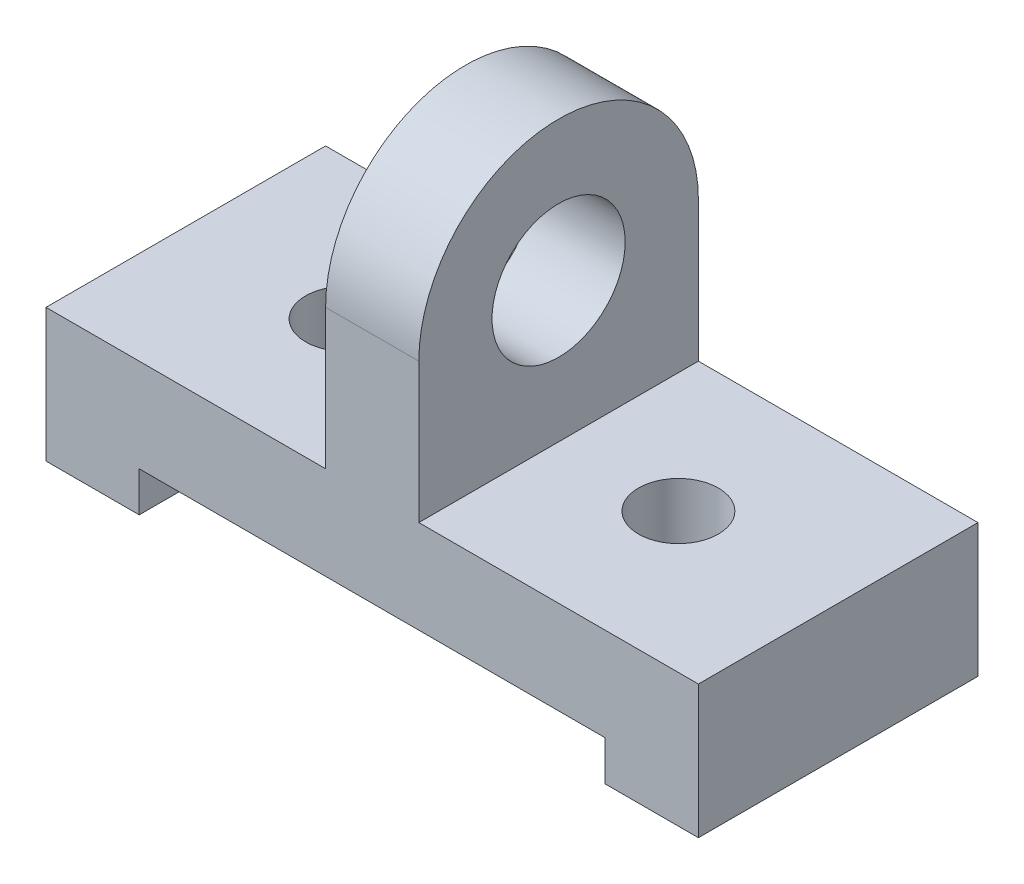
from build123d import *

# Parameters (mm, degrees)
SKETCH1_W                = 98
SKETCH1_H                = 42
BOSS_EXTRUDE1_DEPTH      = 20
SKETCH2_W                = 70
SKETCH2_H                = 6
CUT_EXTRUDE1_DEPTH       = 68.564783726
SKETCH3_R                = 6
CUT_EXTRUDE2_DEPTH       = 14
BOSS_EXTRUDE2_DEPTH      = 7
BOSS_EXTRUDE2_DEPTH_BACK = 7
SKETCH4_W                = 42
SKETCH4_H                = 42
FILLET1_RADIUS           = 21
FILLET1_LENGTH           = 14
SKETCH5_R                = 10
CUT_EXTRUDE3_DEPTH       = 14


with BuildPart() as part:
    # Sketch1 → Boss-Extrude1 (new body)
    with BuildSketch(Plane(origin=(0, 0, 0), x_dir=(1, 0, 0), z_dir=(0, 1, 0))):
        Rectangle(SKETCH1_W, SKETCH1_H)
    extrude(amount=BOSS_EXTRUDE1_DEPTH)

    # Sketch2 → Cut-Extrude1 (cut, through all)
    with BuildSketch(Plane.XY.offset(21)):
        with Locations((0, 3)):
            Rectangle(SKETCH2_W, SKETCH2_H)
    extrude(amount=-CUT_EXTRUDE1_DEPTH, mode=Mode.SUBTRACT)

    # Sketch3 → Cut-Extrude2 (cut)
    with BuildSketch(Plane(origin=(0, 20, 0), x_dir=(1, 0, 0), z_dir=(0, 1, 0))):
        with Locations(Location((25, 0, 0), (0, 0, 270))):
            Circle(SKETCH3_R)
        with Locations(Location((-25, 0, 0), (0, 0, 270))):
            Circle(SKETCH3_R)
    extrude(amount=-CUT_EXTRUDE2_DEPTH, mode=Mode.SUBTRACT)

    # Sketch4 → Boss-Extrude2 (add, two sides: drawn at the far end of the back side and taken through both)
    with BuildSketch(Plane(origin=(0, 0, 0), x_dir=(0, 0, -1), z_dir=(1, 0, 0)).offset(-BOSS_EXTRUDE2_DEPTH_BACK)):
        with Locations((0, 41)):
            Rectangle(SKETCH4_W, SKETCH4_H)
    extrude(amount=BOSS_EXTRUDE2_DEPTH + BOSS_EXTRUDE2_DEPTH_BACK)

    # Fillet1: full round fillet: the end face becomes a half cylinder, R = half its width
    fillet1_face = Plane((0, 62, 0), x_dir=(1, 0, 0), z_dir=(0, 1, 0))  # on the end face: x along it, z out of the body
    fillet1_slab = fillet1_face.offset(-FILLET1_RADIUS / 2) * Box(FILLET1_LENGTH, 2 * FILLET1_RADIUS, FILLET1_RADIUS, mode=Mode.PRIVATE)  # the body's end, R deep
    fillet1_round = Plane((0, 41, 0), x_dir=(0, 1, 0), z_dir=(1, 0, 0)) * Cylinder(FILLET1_RADIUS, FILLET1_LENGTH, mode=Mode.PRIVATE)  # its axis R under the face
    add(fillet1_slab - fillet1_round, mode=Mode.SUBTRACT)

    # Sketch5 → Cut-Extrude3 (cut)
    with BuildSketch(Plane(origin=(7, 0, 0), x_dir=(0, 0, -1), z_dir=(1, 0, 0))):
        with Locations((0, 41)):
            Circle(SKETCH5_R)
    extrude(amount=-CUT_EXTRUDE3_DEPTH, mode=Mode.SUBTRACT)


solid = part.part
